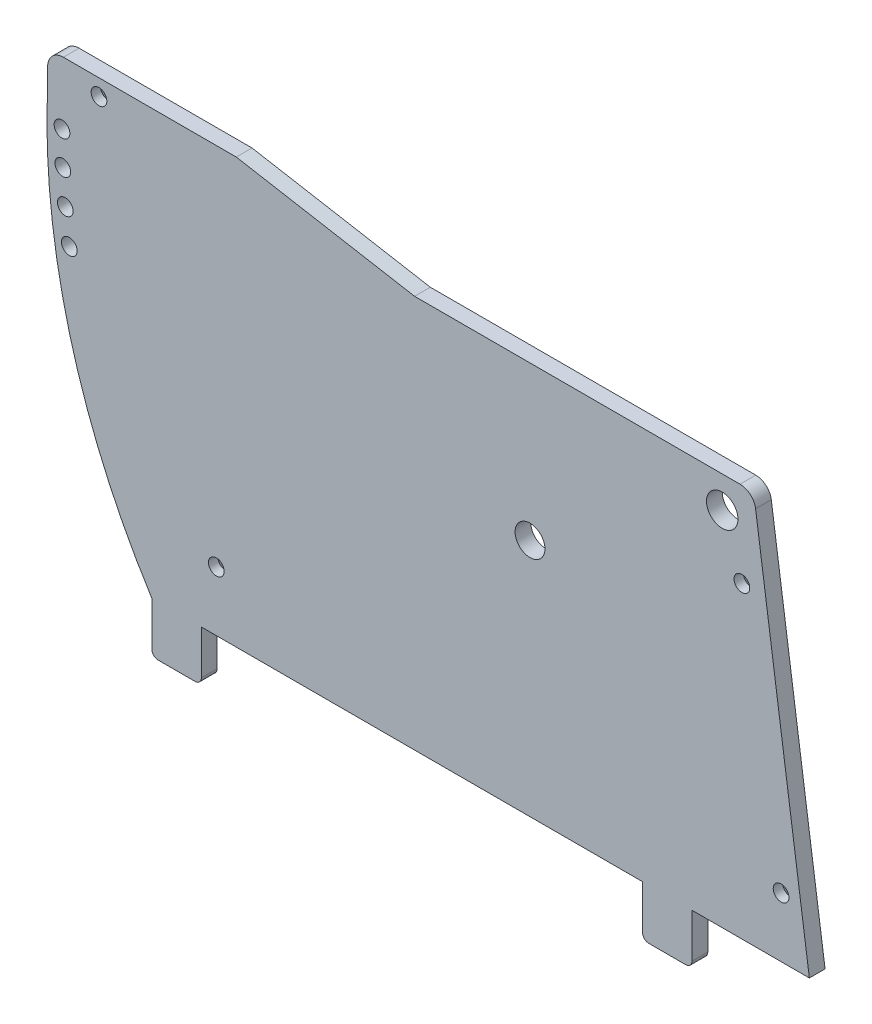
from build123d import *

# Parameters (mm, degrees)
SKETCH18_R          = 1.905
SKETCH18_R_2        = 3.175
SKETCH18_R_3        = 6.35
SKETCH18_R_4        = 2.5
SKETCH18_R_5        = 10.922
BOSS_EXTRUDE4_DEPTH = 6.35
CHAMFER1_SIZE       = 2.54
SKETCH19_R          = 32.808821981
BOSS_EXTRUDE5_DEPTH = 6.35
SKETCH20_R          = 6.0325
CUT_EXTRUDE1_DEPTH  = 6.35
SKETCH22_W          = 20
SKETCH22_H          = 6.35
BOSS_EXTRUDE6_DEPTH = 20.32
FILLET1_R           = 2.54


with BuildPart() as part:
    # Sketch18 → Boss-Extrude4 (new body)
    with BuildSketch(Plane.XY):
        with BuildLine():
            Line((0, 0), (-265.604745697, 0))
            ThreePointArc((-265.604745697, 0), (-298.882523776, 76.131915965), (-307.699061234, 158.75))
            Line((-307.699061234, 158.75), (-307.699061234, 165.1))
            ThreePointArc((-307.699061234, 165.1), (-305.839189294, 169.590128061), (-301.349061234, 171.45))
            Line((-301.349061234, 171.45), (-231.499061234, 171.45))
            Line((-231.499061234, 171.45), (-159.473782125, 158.75))
            Line((-159.473782125, 158.75), (-28.014368889, 158.75))
            ThreePointArc((-28.014368889, 158.75), (-23.851207857, 157.194850386), (-21.727208485, 153.291130779))
            Line((-21.727208485, 153.291130779), (0, 0))
        make_face()
        with Locations((-180.594, 136.144)):
            Circle(SKETCH18_R, mode=Mode.SUBTRACT)
        with Locations((-11.423473622, 24.034728138)):
            Circle(SKETCH18_R_2, mode=Mode.SUBTRACT)
        with Locations((-27.253356194, 124.406511892)):
            Circle(SKETCH18_R_2, mode=Mode.SUBTRACT)
        with Locations((-35.200938766, 146.05)):
            Circle(SKETCH18_R_3, mode=Mode.SUBTRACT)
        with Locations((-301.900938766, 146.05)):
            Circle(SKETCH18_R_2, mode=Mode.SUBTRACT)
        with Locations((-301.569673588, 132.761391752)):
            Circle(SKETCH18_R_2, mode=Mode.SUBTRACT)
        with Locations((-300.579872803, 119.537524267)):
            Circle(SKETCH18_R_2, mode=Mode.SUBTRACT)
        with Locations((-298.943543444, 106.442822899)):
            Circle(SKETCH18_R_2, mode=Mode.SUBTRACT)
        with Locations((-239.568937637, 24.034728138)):
            Circle(SKETCH18_R_2, mode=Mode.SUBTRACT)
        with Locations((-286.962142025, 164.850708953)):
            Circle(SKETCH18_R_2, mode=Mode.SUBTRACT)
        with Locations((-187.097045256, 107.95)):
            Circle(SKETCH18_R_4, mode=Mode.SUBTRACT)
        with Locations((-180.594, 105.156)):
            Circle(SKETCH18_R, mode=Mode.SUBTRACT)
        with Locations((-165.1, 120.65)):
            Circle(SKETCH18_R_5, mode=Mode.SUBTRACT)
        with Locations((-165.1, 146.05)):
            Circle(SKETCH18_R_4, mode=Mode.SUBTRACT)
        with Locations((-149.606, 105.156)):
            Circle(SKETCH18_R, mode=Mode.SUBTRACT)
        with Locations((-149.606, 136.144)):
            Circle(SKETCH18_R, mode=Mode.SUBTRACT)
        with Locations((-143.102954744, 107.95)):
            Circle(SKETCH18_R_4, mode=Mode.SUBTRACT)
    extrude(amount=BOSS_EXTRUDE4_DEPTH)

    # Chamfer1
    chamfer1_edges = [part.edges().sort_by_distance(p)[0] for p in [
        (-14.598473622, 24.034728138, 0),
        (-30.428356194, 124.406511892, 0),
        (-242.743937637, 24.034728138, 0),
        (-290.137142025, 164.850708953, 0),
    ]]
    chamfer(chamfer1_edges, length=CHAMFER1_SIZE)

    # Sketch19 → Boss-Extrude5 (add)
    with BuildSketch(Plane(origin=(0, 0, 0), x_dir=(-1, 0, 0), z_dir=(0, 0, -1))):
        with Locations((165.1, 120.65)):
            Circle(SKETCH19_R)
    extrude(amount=-BOSS_EXTRUDE5_DEPTH)

    # Sketch20 → Cut-Extrude1 (cut)
    with BuildSketch(Plane(origin=(0, 0, 0), x_dir=(-1, 0, 0), z_dir=(0, 0, -1))):
        with Locations((112.843509564, 96.674296134)):
            Circle(SKETCH20_R)
    extrude(amount=-CUT_EXTRUDE1_DEPTH, mode=Mode.SUBTRACT)

    # Sketch22 → Boss-Extrude6 (add)
    with BuildSketch(Plane.XZ):
        with Locations((-57.384832148, 3.175)):
            Rectangle(SKETCH22_W, SKETCH22_H)
        with Locations((-255.604745697, 3.175)):
            Rectangle(SKETCH22_W, SKETCH22_H)
    extrude(amount=BOSS_EXTRUDE6_DEPTH)

    # Fillet1
    fillet1_edges = [part.edges().sort_by_distance(p)[0] for p in [
        (-67.384832148, -20.32, 3.175),
        (-47.384832148, -20.32, 3.175),
        (-265.604745697, -20.32, 3.175),
        (-245.604745697, -20.32, 3.175),
    ]]
    fillet(fillet1_edges, radius=FILLET1_R)


solid = part.part
